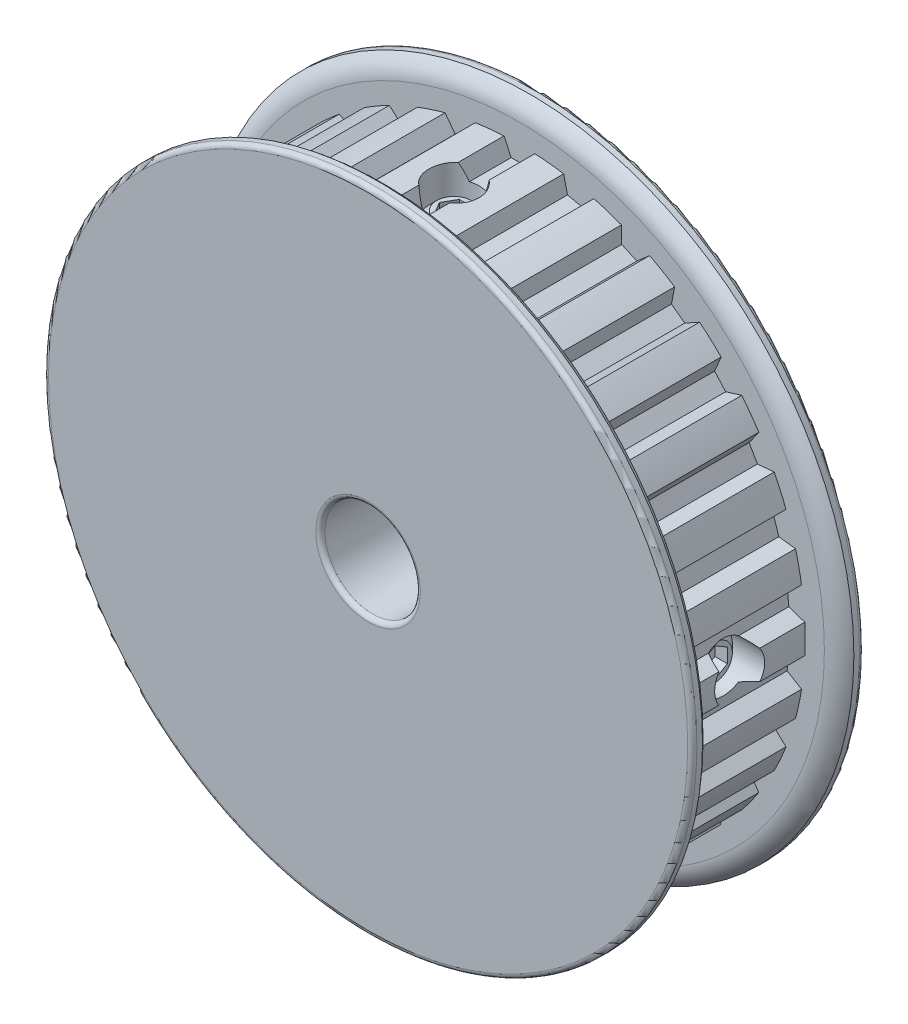
from build123d import *

# Parameters (mm, degrees)
CUT_EXTRUDE1_START = 5.4483
CUT_EXTRUDE1_DEPTH = 10.8966
CIRPATTERN1_COUNT  = 30
FILLET1_R          = 0.381
SKETCH5_R          = 2.0828
CUT_EXTRUDE2_DEPTH = 39.830068933
CUT_EXTRUDE3_DEPTH = 1.0414
CIRPATTERN2_COUNT  = 2
CIRPATTERN2_ANGLE  = 270


with BuildPart() as part:
    # Sketch2 → Revolve1 (revolve)
    with BuildSketch(Plane(origin=(0, 0, 0), x_dir=(0, 0, -1), z_dir=(1, 0, 0)), mode=Mode.PRIVATE) as revolve1_sk:
        with BuildLine():
            Line((-7.1501, 3.96875), (7.1501, 3.96875))
            Line((7.1501, 3.96875), (7.1501, 26.9875))
            Line((7.1501, 26.9875), (6.2992, 26.9875))
            ThreePointArc((6.2992, 26.9875), (5.674225141, 26.292509764), (5.4483, 25.385557267))
            Line((5.4483, 25.385557267), (5.4483, 23.783614534))
            Line((5.4483, 23.783614534), (-5.4483, 23.783614534))
            Line((-5.4483, 23.783614534), (-5.4483, 25.385557267))
            ThreePointArc((-5.4483, 25.385557267), (-5.674225141, 26.292509764), (-6.2992, 26.9875))
            Line((-6.2992, 26.9875), (-7.1501, 26.9875))
            Line((-7.1501, 26.9875), (-7.1501, 3.96875))
        make_face()
    revolve(revolve1_sk.sketch.rotate(Axis((0, 0, 7.1501), (0, 0, -1)), 90), axis=Axis((0, 0, 7.1501), (0, 0, -1)))

    # Sketch3 → Cut-Extrude1 (cut)
    with BuildSketch(Plane.XY.offset(CUT_EXTRUDE1_START)):
        with BuildLine():
            Line((-0.690489274, 22.479), (0.690489274, 22.479))
            Line((0.690489274, 22.479), (1.2827, 23.749))
            ThreePointArc((1.2827, 23.749), (0, 23.783614534), (-1.2827, 23.749))
            Line((-1.2827, 23.749), (-0.690489274, 22.479))
        make_face()
    cut_extrude1 = extrude(amount=-CUT_EXTRUDE1_DEPTH, mode=Mode.SUBTRACT)

    # CirPattern1: Cut-Extrude1 ×30 about axis
    cirpattern1_axis = Axis((0, 0, 0), (0, 0, 1))
    for i in range(1, CIRPATTERN1_COUNT):
        add(cut_extrude1.rotate(cirpattern1_axis, i * 360 / CIRPATTERN1_COUNT), mode=Mode.SUBTRACT)

    # Fillet1
    fillet1_edges = [part.edges().sort_by_distance(p)[0] for p in [
        (-26.9875, 0, -7.1501),
        (-3.96875, 0, -7.1501),
        (-3.96875, 0, 7.1501),
        (-26.9875, 0, 7.1501),
    ]]
    fillet(fillet1_edges, radius=FILLET1_R)

    # Sketch5 → Cut-Extrude2 (cut, through all)
    with BuildSketch(Plane(origin=(0, 0, 0), x_dir=(1, 0, 0), z_dir=(0, 1, 0))):
        with Locations(Location((0, 0, 0), (0, 0, 90))):
            Circle(SKETCH5_R)
    cut_extrude2 = extrude(amount=CUT_EXTRUDE2_DEPTH, mode=Mode.SUBTRACT)

    # Sketch6 → Revolve2 (revolve)
    with BuildSketch(Plane(origin=(0, 0, 0), x_dir=(0, 0, -1), z_dir=(1, 0, 0)), mode=Mode.PRIVATE) as revolve2_sk:
        Polygon((0, 21.717), (0, 4.73075), (-1.45796, 4.73075), (-2.0828, 5.35559), (-2.0828, 21.09216), (-1.45796, 21.717), align=None)
    revolve2 = revolve(revolve2_sk.sketch.rotate(Axis((0, 21.717, 0), (0, -1, 0)), 180), axis=Axis((0, 21.717, 0), (0, -1, 0)))

    # Sketch7 → Cut-Extrude3 (cut)
    with BuildSketch(Plane(origin=(0, 21.717, 0), x_dir=(1, 0, 0), z_dir=(0, 1, 0))):
        Polygon((1.202505141, 0), (0.60125257, 1.0414), (-0.60125257, 1.0414), (-1.202505141, 0), (-0.60125257, -1.0414), (0.60125257, -1.0414), align=None)
    cut_extrude3 = extrude(amount=-CUT_EXTRUDE3_DEPTH, mode=Mode.SUBTRACT)

    # CirPattern2: Cut-Extrude2, Revolve2, Cut-Extrude3 ×2 about axis
    cirpattern2_axis = Axis((0, 0, 0), (0, 0, 1))
    add([cut_extrude2.rotate(cirpattern2_axis, i * CIRPATTERN2_ANGLE / (CIRPATTERN2_COUNT - 1)) for i in range(1, CIRPATTERN2_COUNT)], mode=Mode.SUBTRACT)
    add([revolve2.rotate(cirpattern2_axis, i * CIRPATTERN2_ANGLE / (CIRPATTERN2_COUNT - 1)) for i in range(1, CIRPATTERN2_COUNT)])
    add([cut_extrude3.rotate(cirpattern2_axis, i * CIRPATTERN2_ANGLE / (CIRPATTERN2_COUNT - 1)) for i in range(1, CIRPATTERN2_COUNT)], mode=Mode.SUBTRACT)


solid = part.part
